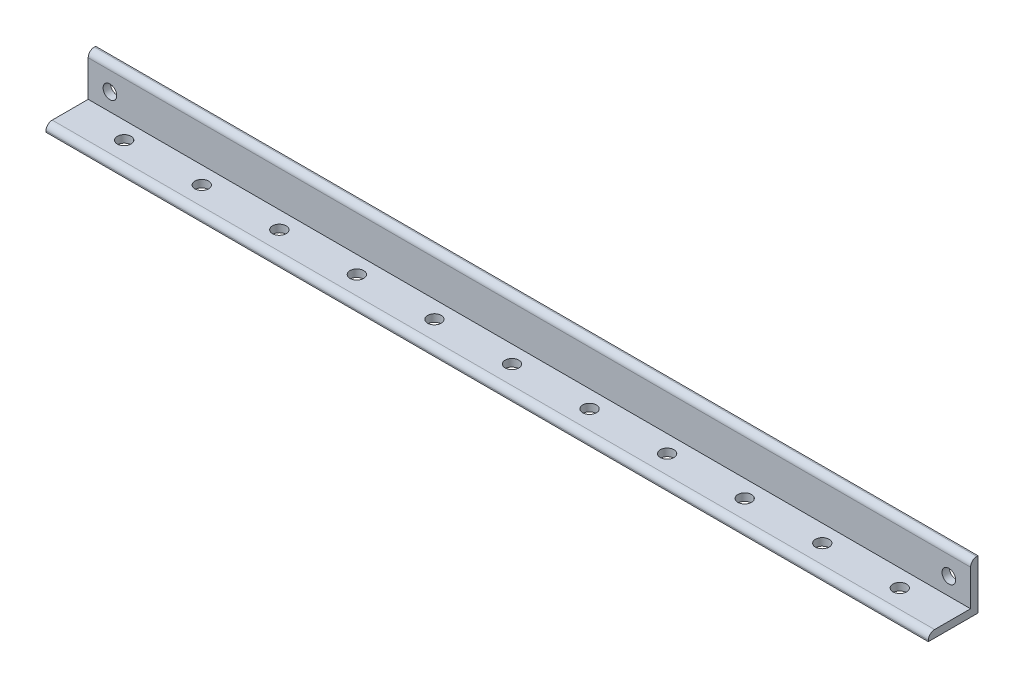
from build123d import *

# Parameters (mm, degrees)
SKETCH_1_W             = 1422
SKETCH_1_H             = 80
EXTRUDE_1_DEPTH        = 80
SKETCH_3_W             = 68
SKETCH_3_H             = 68
CUT_EXTRUDE_2_DEPTH    = 1427.49360321
FILLET_1_R             = 10
SKETCH_4_R             = 11
CUT_EXTRUDE_3_DEPTH    = 1427.49360321
PATTERN_LINEAR_1_COUNT = 2
PATTERN_LINEAR_1_PITCH = 1352
SKETCH_5_R             = 11
CUT_EXTRUDE_4_DEPTH    = 1427.49360321
PATTERN_LINEAR_2_COUNT = 11
PATTERN_LINEAR_2_PITCH = 125


with BuildPart() as part:
    # 草图1 → 拉伸1 (new body)
    with BuildSketch(Plane.XY):
        with Locations((711, 40)):
            Rectangle(SKETCH_1_W, SKETCH_1_H)
    extrude(amount=EXTRUDE_1_DEPTH)

    # 草图3 → 拉伸2 (cut, through all)
    with BuildSketch(Plane.ZY):
        with Locations((46, 46)):
            Rectangle(SKETCH_3_W, SKETCH_3_H)
    extrude(amount=-CUT_EXTRUDE_2_DEPTH, mode=Mode.SUBTRACT)

    # 圆角1
    fillet_1_edges = [part.edges().sort_by_distance(p)[0] for p in [
        (711, 80, 12),
        (711, 12, 80),
    ]]
    fillet(fillet_1_edges, radius=FILLET_1_R)

    # 草图4 → 拉伸3 (cut, through all)
    with BuildSketch(Plane(origin=(0, 0, 0), x_dir=(-1, 0, 0), z_dir=(0, 0, -1))):
        with Locations((-1387, 40)):
            Circle(SKETCH_4_R)
    cut_extrude_3 = extrude(amount=-CUT_EXTRUDE_3_DEPTH, mode=Mode.SUBTRACT)

    # 阵列(线性)1: 拉伸3 ×2
    with Locations(*[(-i * PATTERN_LINEAR_1_PITCH, 0, 0) for i in range(1, PATTERN_LINEAR_1_COUNT)]):
        add(cut_extrude_3, mode=Mode.SUBTRACT)

    # 草图5 → 拉伸4 (cut, through all)
    with BuildSketch(Plane.XZ):
        with Locations(Location((86, 40, 0), (0, 0, 270))):
            Circle(SKETCH_5_R)
    cut_extrude_4 = extrude(amount=-CUT_EXTRUDE_4_DEPTH, mode=Mode.SUBTRACT)

    # 阵列(线性)2: 拉伸4 ×11
    with Locations(*[(i * PATTERN_LINEAR_2_PITCH, 0, 0) for i in range(1, PATTERN_LINEAR_2_COUNT)]):
        add(cut_extrude_4, mode=Mode.SUBTRACT)


solid = part.part
